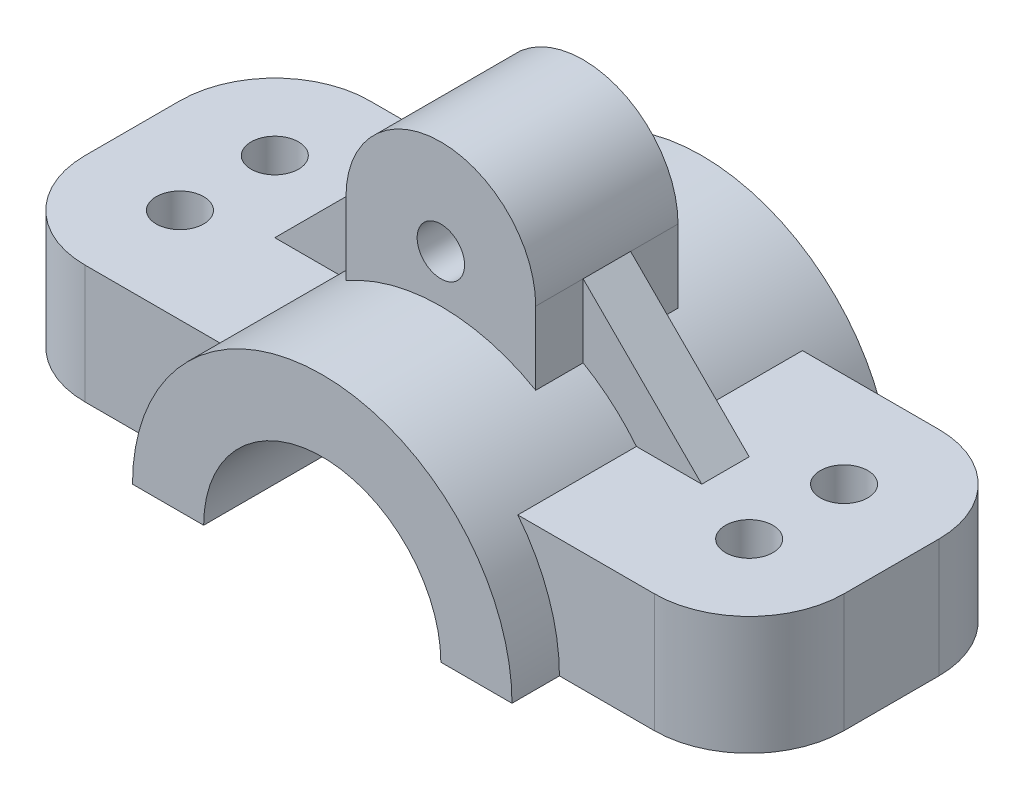
from build123d import *

# Parameters (mm, degrees)
BOSS_EXTRUDE1_DEPTH        = 40
BOSS_EXTRUDE2_DEPTH        = 30
BOSS_EXTRUDE3_DEPTH        = 5
SKETCH1_6_R                = 5
BOSS_EXTRUDE4_DEPTH        = 15
F_10_0_10_DIAMETER_HOLE1_D = 10
FILLET2_R                  = 20


with BuildPart() as part:
    # Sketch1 → Boss-Extrude1 (new, symmetric)
    with BuildSketch(Plane.XY):
        with BuildLine():
            ThreePointArc((-31.224989992, 25), (-37.742546282, 13.247648854), (-40, 0))
            Line((-40, 0), (-25, 0))
            ThreePointArc((-25, 0), (0, 25), (25, 0))
            Line((25, 0), (40, 0))
            ThreePointArc((40, 0), (37.742546282, 13.247648854), (31.224989992, 25))
            ThreePointArc((31.224989992, 25), (26.062179457, 30.344073589), (20, 34.641016151))
            ThreePointArc((20, 34.641016151), (0, 40), (-20, 34.641016151))
            ThreePointArc((-20, 34.641016151), (-26.062179457, 30.344073589), (-31.224989992, 25))
        make_face()
    extrude(amount=BOSS_EXTRUDE1_DEPTH, both=True)

    # Sketch1<3> → Boss-Extrude2 (add, symmetric)
    with BuildSketch(Plane.XY):
        with BuildLine():
            Line((-80, 25), (-80, 0))
            Line((-80, 0), (-40, 0))
            ThreePointArc((-40, 0), (-37.742546282, 13.247648854), (-31.224989992, 25))
            Line((-31.224989992, 25), (-80, 25))
        make_face()
        with BuildLine():
            ThreePointArc((31.224989992, 25), (37.742546282, 13.247648854), (40, 0))
            Line((40, 0), (80, 0))
            Line((80, 0), (80, 25))
            Line((80, 25), (31.224989992, 25))
        make_face()
    extrude(amount=BOSS_EXTRUDE2_DEPTH, both=True)

    # Sketch1<5> → Boss-Extrude3 (add, symmetric)
    with BuildSketch(Plane.XY):
        with BuildLine():
            Line((-45, 25), (-31.224989992, 25))
            ThreePointArc((-31.224989992, 25), (-26.062179457, 30.344073589), (-20, 34.641016151))
            Line((-20, 34.641016151), (-20, 50))
            Line((-20, 50), (-45, 25))
        make_face()
        with BuildLine():
            Line((20, 50), (20, 34.641016151))
            ThreePointArc((20, 34.641016151), (26.062179457, 30.344073589), (31.224989992, 25))
            Line((31.224989992, 25), (45, 25))
            Line((45, 25), (20, 50))
        make_face()
    extrude(amount=BOSS_EXTRUDE3_DEPTH, both=True)

    # Sketch1<6> → Boss-Extrude4 (add, symmetric)
    with BuildSketch(Plane.XY):
        with BuildLine():
            Line((-20, 50), (-20, 34.641016151))
            ThreePointArc((-20, 34.641016151), (0, 40), (20, 34.641016151))
            Line((20, 34.641016151), (20, 50))
            ThreePointArc((20, 50), (0, 70), (-20, 50))
        make_face()
        with Locations((0, 50)):
            Circle(SKETCH1_6_R, mode=Mode.SUBTRACT)
    extrude(amount=BOSS_EXTRUDE4_DEPTH, both=True)

    # Ø10.0 (10) Diameter Hole1 (through all)
    with Locations(Plane(origin=(-60, 25, -10), x_dir=(1, 0, 0), z_dir=(0, 1, 0))):
        with Locations((0, 0), (0, -20), (120, -20), (120, 0)):
            Hole(F_10_0_10_DIAMETER_HOLE1_D / 2)

    # Fillet2
    fillet2_edges = [part.edges().sort_by_distance(p)[0] for p in [
        (80, 12.5, -30),
        (80, 12.5, 30),
        (-80, 12.5, 30),
        (-80, 12.5, -30),
    ]]
    fillet(fillet2_edges, radius=FILLET2_R)


solid = part.part
